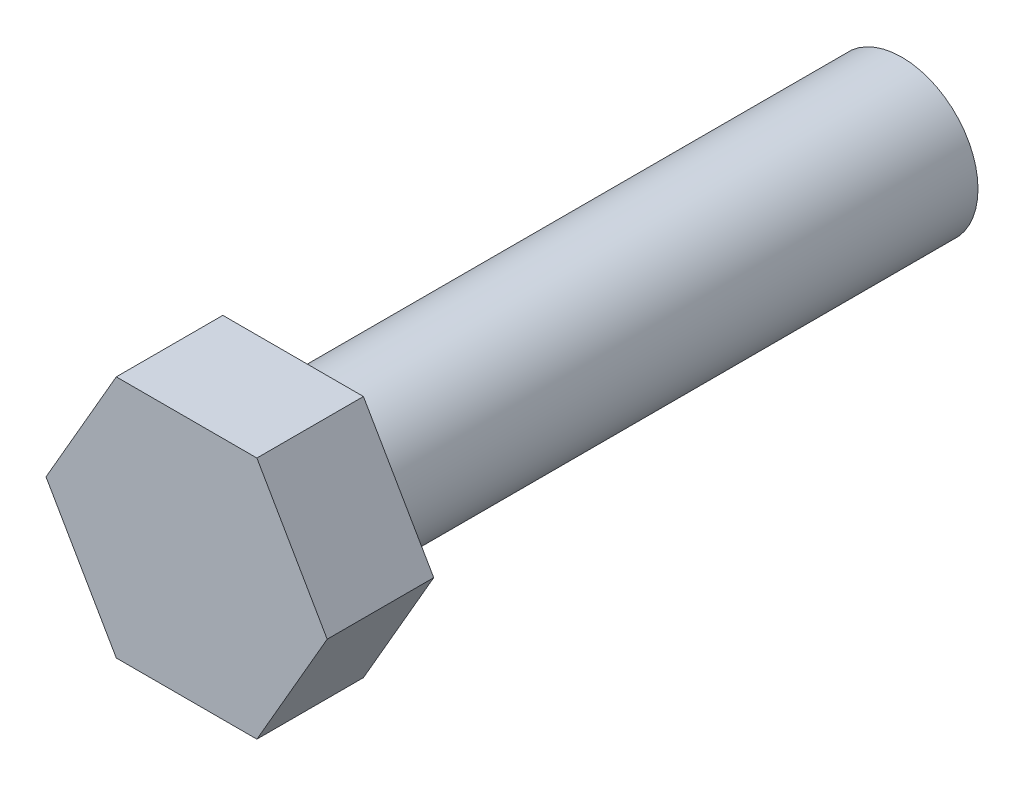
from build123d import *

# Parameters (mm, degrees)
SALIENTE_EXTRUIR1_DEPTH = 3.5
CROQUIS2_R              = 2.5
SALIENTE_EXTRUIR2_DEPTH = 20


with BuildPart() as part:
    # Croquis1 → Saliente-Extruir1 (new body)
    with BuildSketch(Plane.XY):
        Polygon((4.618802154, 0), (2.309401077, 4), (-2.309401077, 4), (-4.618802154, 0), (-2.309401077, -4), (2.309401077, -4), align=None)
    extrude(amount=SALIENTE_EXTRUIR1_DEPTH)

    # Croquis2 → Saliente-Extruir2 (add)
    with BuildSketch(Plane(origin=(0, 0, 0), x_dir=(-1, 0, 0), z_dir=(0, 0, -1))):
        with Locations(Location((0, 0, 0), (0, 0, 180))):
            Circle(CROQUIS2_R)
    extrude(amount=SALIENTE_EXTRUIR2_DEPTH)


solid = part.part
